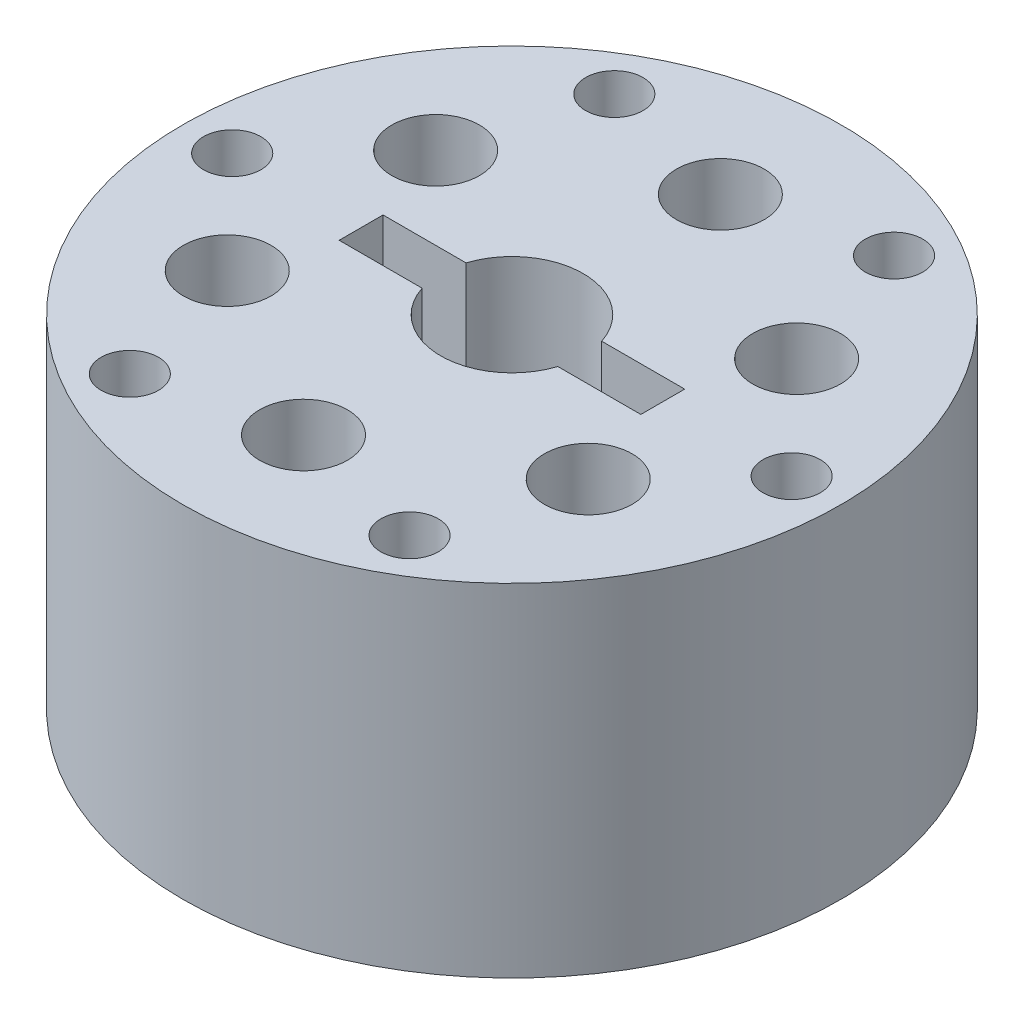
from build123d import *

# Parameters (mm, degrees)
SKETCH1_R                      = 30
BOSS_EXTRUDE1_DEPTH            = 31.16
CUT_EXTRUDE1_DEPTH             = 29.16
CBORE_FOR_M4_SHCS1_D           = 4.5
CBORE_FOR_M4_SHCS1_CBORE_D     = 8
CBORE_FOR_M4_SHCS1_CBORE_DEPTH = 11
SKETCH7_R                      = 2.3495
CUT_EXTRUDE2_DEPTH             = 29.16
SKETCH9_R                      = 2.6162
CUT_EXTRUDE3_DEPTH             = 6.35


with BuildPart() as part:
    # Sketch1 → Boss-Extrude1 (new body)
    with BuildSketch(Plane(origin=(0, 0, 0), x_dir=(1, 0, 0), z_dir=(0, 1, 0))):
        with Locations(Location((0, 0, 0), (0, 0, 270))):
            Circle(SKETCH1_R)
    extrude(amount=BOSS_EXTRUDE1_DEPTH)

    # Sketch2 → Cut-Extrude1 (cut)
    with BuildSketch(Plane(origin=(0, 31.16, 0), x_dir=(1, 0, 0), z_dir=(0, 1, 0))):
        with BuildLine():
            Line((-6.184658438, -2), (-13.75, -2))
            Line((-13.75, -2), (-13.75, 2))
            Line((-13.75, 2), (-6.184658438, 2))
            ThreePointArc((-6.184658438, 2), (0, 6.5), (6.184658438, 2))
            Line((6.184658438, 2), (13.75, 2))
            Line((13.75, 2), (13.75, -2))
            Line((13.75, -2), (6.184658438, -2))
            ThreePointArc((6.184658438, -2), (0, -6.5), (-6.184658438, -2))
        make_face()
    extrude(amount=-CUT_EXTRUDE1_DEPTH, mode=Mode.SUBTRACT)

    # CBORE for M4 SHCS1 (through all)
    with Locations(Plane(origin=(0, 31.16, 0), x_dir=(1, 0, 0), z_dir=(0, 1, 0))):
        with Locations((0, 19), (-16.454482672, 9.5), (-16.454482672, -9.5), (0, -19), (16.454482672, -9.5), (16.454482672, 9.5)):
            CounterBoreHole(CBORE_FOR_M4_SHCS1_D / 2, CBORE_FOR_M4_SHCS1_CBORE_D / 2, CBORE_FOR_M4_SHCS1_CBORE_DEPTH)

    # Sketch7 → Cut-Extrude2 (cut)
    with BuildSketch(Plane(origin=(0, 31.16, 0), x_dir=(1, 0, 0), z_dir=(0, 1, 0))):
        with Locations(Location((-25.5, 0, 0), (0, 0, 270))):
            Circle(SKETCH7_R)
        with Locations(Location((-12.75, 22.083647797, 0), (0, 0, 270))):
            Circle(SKETCH7_R)
        with Locations(Location((12.75, 22.083647797, 0), (0, 0, 270))):
            Circle(SKETCH7_R)
        with Locations(Location((25.5, 0, 0), (0, 0, 270))):
            Circle(SKETCH7_R)
        with Locations(Location((12.75, -22.083647797, 0), (0, 0, 270))):
            Circle(SKETCH7_R)
        with Locations(Location((-12.75, -22.083647797, 0), (0, 0, 270))):
            Circle(SKETCH7_R)
    extrude(amount=-CUT_EXTRUDE2_DEPTH, mode=Mode.SUBTRACT)

    # Sketch9 → Cut-Extrude3 (cut)
    with BuildSketch(Plane(origin=(0, 31.16, 0), x_dir=(1, 0, 0), z_dir=(0, 1, 0))):
        with Locations(Location((-12.75, 22.083647797, 0), (0, 0, 270))):
            Circle(SKETCH9_R)
        with Locations(Location((12.75, 22.083647797, 0), (0, 0, 270))):
            Circle(SKETCH9_R)
        with Locations(Location((25.5, 0, 0), (0, 0, 270))):
            Circle(SKETCH9_R)
        with Locations(Location((12.75, -22.083647797, 0), (0, 0, 270))):
            Circle(SKETCH9_R)
        with Locations(Location((-12.75, -22.083647797, 0), (0, 0, 270))):
            Circle(SKETCH9_R)
        with Locations(Location((-25.5, 0, 0), (0, 0, 270))):
            Circle(SKETCH9_R)
    extrude(amount=-CUT_EXTRUDE3_DEPTH, mode=Mode.SUBTRACT)


solid = part.part
